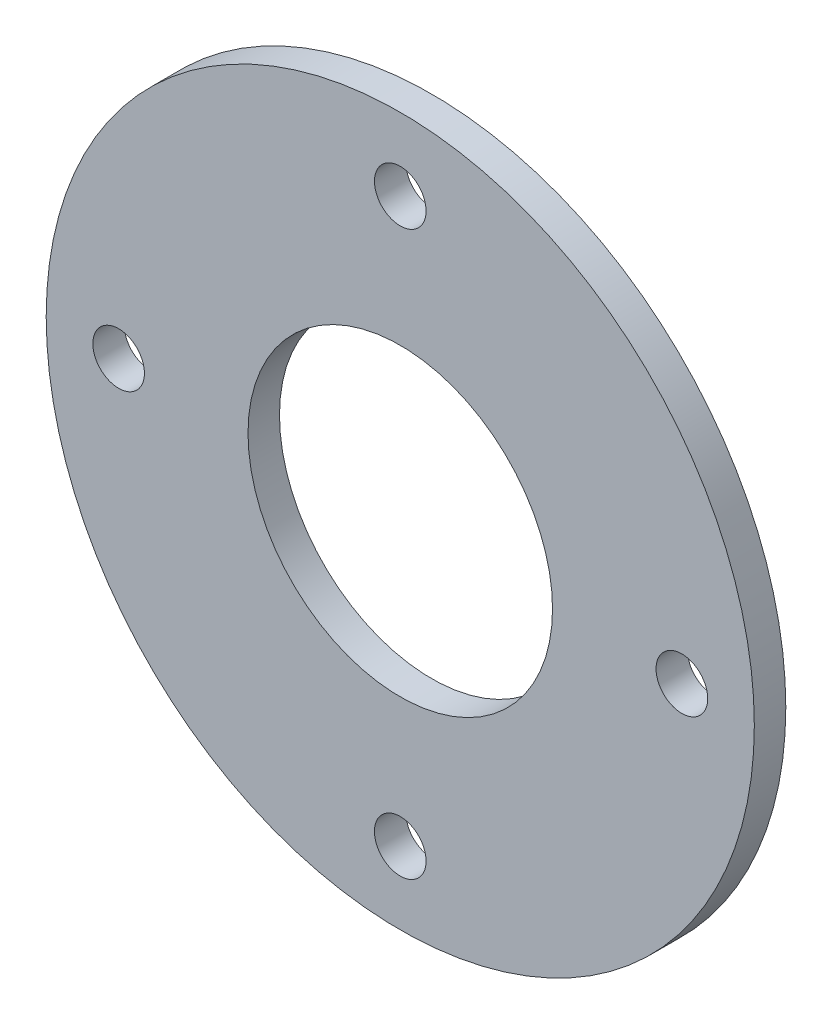
from build123d import *

# Parameters (mm, degrees)
SKETCH1_R               = 114.3
SKETCH1_R_2             = 49.149999464
EXTRUDE1_DEPTH          = 10.16
F_5_8_CLEARANCE_HOLE1_D = 16.66748


with BuildPart() as part:
    # Sketch1 → Extrude1 (new body)
    with BuildSketch(Plane.XY):
        Circle(SKETCH1_R)
        Circle(SKETCH1_R_2, mode=Mode.SUBTRACT)
    extrude(amount=EXTRUDE1_DEPTH)

    # 5/8 Clearance Hole1 (through all)
    with Locations(Plane(origin=(-61.229912904, -86.94526051, 0), x_dir=(-1, 0, 0), z_dir=(0, 0, -1))):
        with Locations((-61.229912904, 177.798020209), (29.681467244, 86.94526051), (-61.229912904, -3.966119638), (-152.141293051, 86.94526051)):
            Hole(F_5_8_CLEARANCE_HOLE1_D / 2)


solid = part.part
